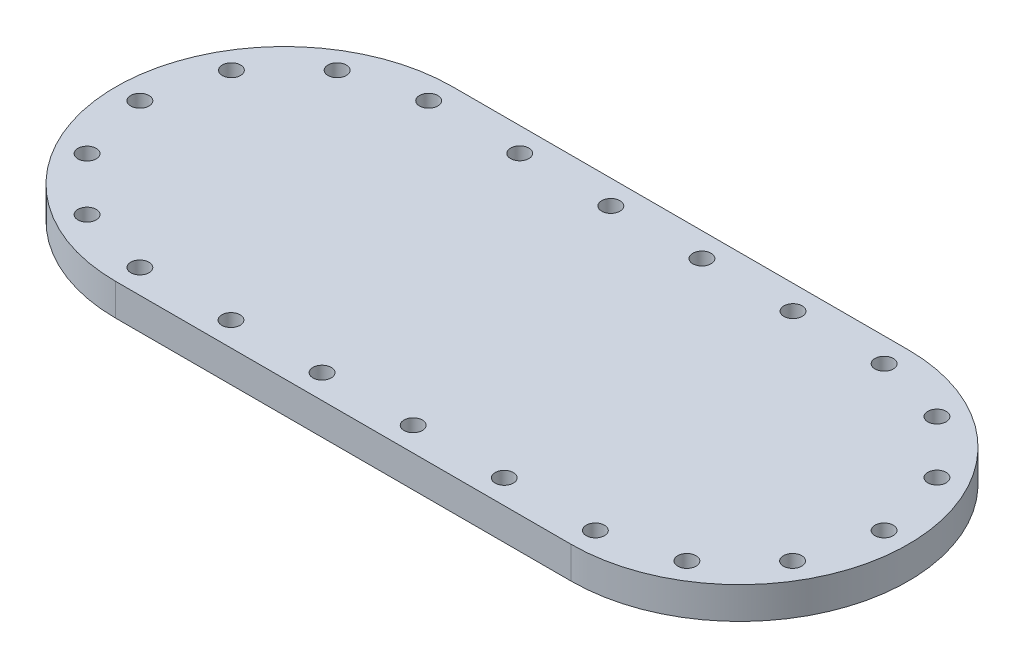
from build123d import *

# Parameters (mm, degrees)
BOSS_EXTRUDE1_DEPTH = 8.89
SKETCH4_R           = 2.5527
CUT_EXTRUDE1_DEPTH  = 121.395732067


with BuildPart() as part:
    # Sketch1 → Boss-Extrude1 (new body)
    with BuildSketch(Plane(origin=(0, 0, 0), x_dir=(1, 0, 0), z_dir=(0, 1, 0))):
        with BuildLine():
            Line((-63.5, 46.99), (63.5, 46.99))
            ThreePointArc((63.5, 46.99), (110.49, 0), (63.5, -46.99))
            Line((63.5, -46.99), (-63.5, -46.99))
            ThreePointArc((-63.5, -46.99), (-110.49, 0), (-63.5, 46.99))
        make_face()
    extrude(amount=BOSS_EXTRUDE1_DEPTH)

    # Sketch4 → Cut-Extrude1 (cut, through all)
    with BuildSketch(Plane.XZ):
        with Locations(Location((83.6295, -34.865316731, 0), (0, 0, 270))):
            Circle(SKETCH4_R)
        with Locations(Location((63.5, -40.259, 0), (0, 0, 270))):
            Circle(SKETCH4_R)
        with Locations(Location((38.1, -40.259, 0), (0, 0, 270))):
            Circle(SKETCH4_R)
        with Locations(Location((12.7, -40.259, 0), (0, 0, 270))):
            Circle(SKETCH4_R)
        with Locations(Location((-12.7, -40.259, 0), (0, 0, 270))):
            Circle(SKETCH4_R)
        with Locations(Location((-38.1, -40.259, 0), (0, 0, 270))):
            Circle(SKETCH4_R)
        with Locations(Location((-63.5, -40.259, 0), (0, 0, 270))):
            Circle(SKETCH4_R)
        with Locations(Location((-83.6295, -34.865316731, 0), (0, 0, 270))):
            Circle(SKETCH4_R)
        with Locations(Location((-98.365316731, -20.1295, 0), (0, 0, 270))):
            Circle(SKETCH4_R)
        with Locations(Location((-103.759, 0, 0), (0, 0, 270))):
            Circle(SKETCH4_R)
        with Locations(Location((-98.365316731, 20.1295, 0), (0, 0, 270))):
            Circle(SKETCH4_R)
        with Locations(Location((-83.6295, 34.865316731, 0), (0, 0, 270))):
            Circle(SKETCH4_R)
        with Locations(Location((-63.5, 40.259, 0), (0, 0, 270))):
            Circle(SKETCH4_R)
        with Locations(Location((-38.1, 40.259, 0), (0, 0, 270))):
            Circle(SKETCH4_R)
        with Locations(Location((-12.7, 40.259, 0), (0, 0, 270))):
            Circle(SKETCH4_R)
        with Locations(Location((12.7, 40.259, 0), (0, 0, 270))):
            Circle(SKETCH4_R)
        with Locations(Location((38.1, 40.259, 0), (0, 0, 270))):
            Circle(SKETCH4_R)
        with Locations(Location((63.5, 40.259, 0), (0, 0, 270))):
            Circle(SKETCH4_R)
        with Locations(Location((83.6295, 34.865316731, 0), (0, 0, 270))):
            Circle(SKETCH4_R)
        with Locations(Location((98.365316731, 20.1295, 0), (0, 0, 270))):
            Circle(SKETCH4_R)
        with Locations(Location((103.759, 0, 0), (0, 0, 270))):
            Circle(SKETCH4_R)
        with Locations(Location((98.365316731, -20.1295, 0), (0, 0, 270))):
            Circle(SKETCH4_R)
    extrude(amount=-CUT_EXTRUDE1_DEPTH, mode=Mode.SUBTRACT)


solid = part.part
